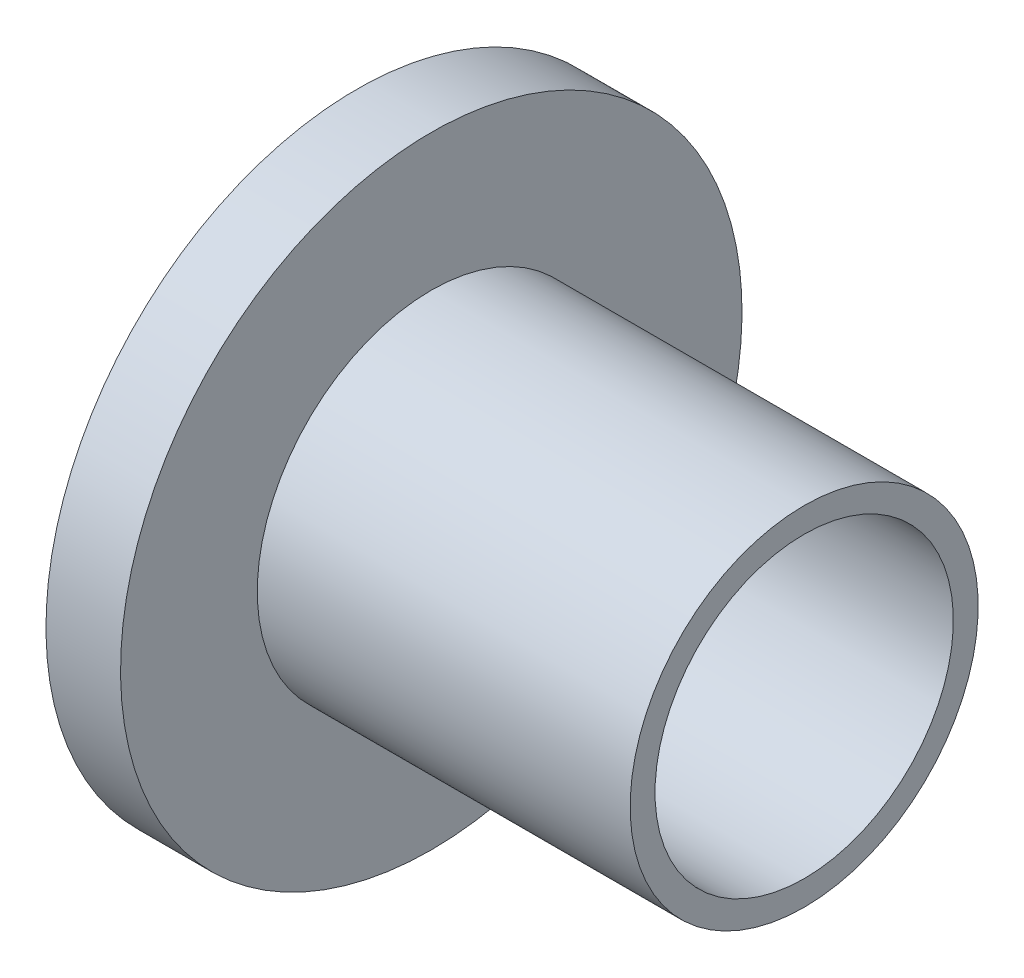
from build123d import *


with BuildPart() as part:
    # Sketch1 → Revolve1 (revolve)
    with BuildSketch(Plane.XY, mode=Mode.PRIVATE) as revolve1_sk:
        Polygon((-6, 25), (-6, 10), (0, 10), (0, 12), (30, 12), (30, 14), (0, 14), (0, 25), align=None)
    revolve(revolve1_sk.sketch.rotate(Axis((-64.900117457, 0, 0), (1, 0, 0)), 180), axis=Axis((-64.900117457, 0, 0), (1, 0, 0)))


solid = part.part
